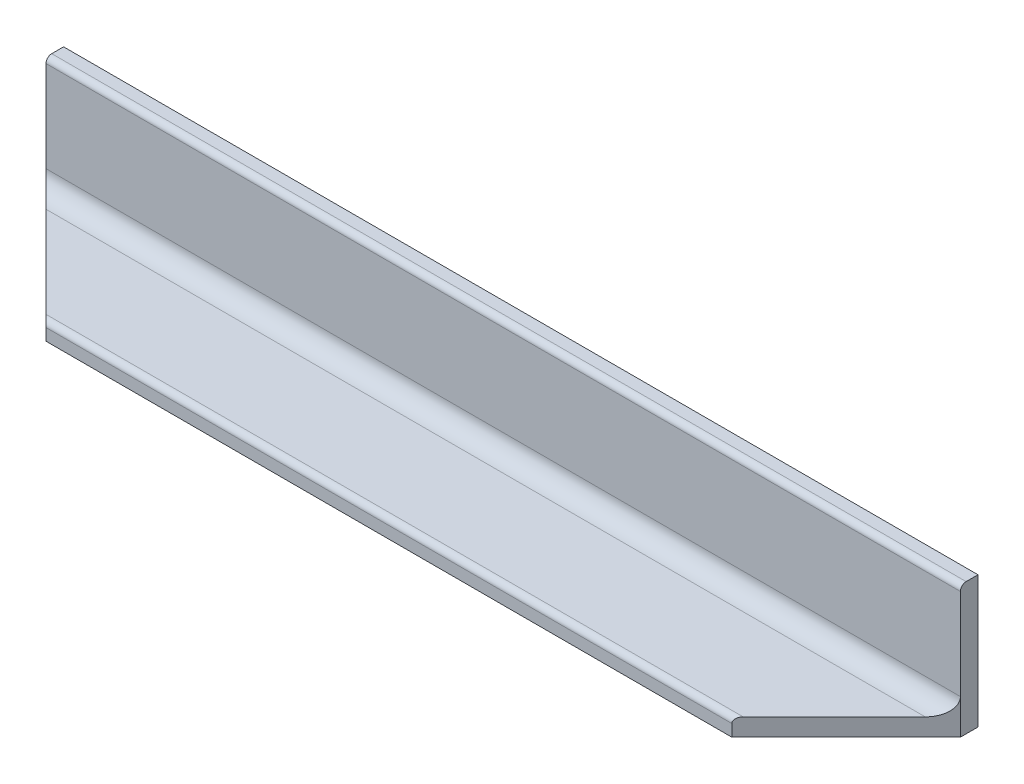
from build123d import *

# Parameters (mm, degrees)
EXTRUDE_1_DEPTH     = 104
CUT_EXTRUDE_1_DEPTH = 113.320968657


with BuildPart() as part:
    # Эскиз1 → Бобышка-Вытянуть1 (new, symmetric)
    with BuildSketch(Plane(origin=(0, 0, 0), x_dir=(0, 0, -1), z_dir=(1, 0, 0))):
        with BuildLine():
            Line((0, 0), (0, 30))
            Line((0, 30), (-2.7, 30))
            ThreePointArc((-2.7, 30), (-3.619238816, 29.619238816), (-4, 28.7))
            Line((-4, 28.7), (-4, 8))
            ThreePointArc((-4, 8), (-5.171572875, 5.171572875), (-8, 4))
            Line((-8, 4), (-28.7, 4))
            ThreePointArc((-28.7, 4), (-29.619238816, 3.619238816), (-30, 2.7))
            Line((-30, 2.7), (-30, 0))
            Line((-30, 0), (0, 0))
        make_face()
    extrude(amount=EXTRUDE_1_DEPTH, both=True)

    # Эскиз2 → Вырез-Вытянуть1 (cut, through all)
    with BuildSketch(Plane.XZ):
        Polygon((-104, 4), (-78, 30), (-104, 30), align=None)
        Polygon((104, 4), (78, 30), (104, 30), align=None)
    extrude(amount=-CUT_EXTRUDE_1_DEPTH, mode=Mode.SUBTRACT)


solid = part.part
